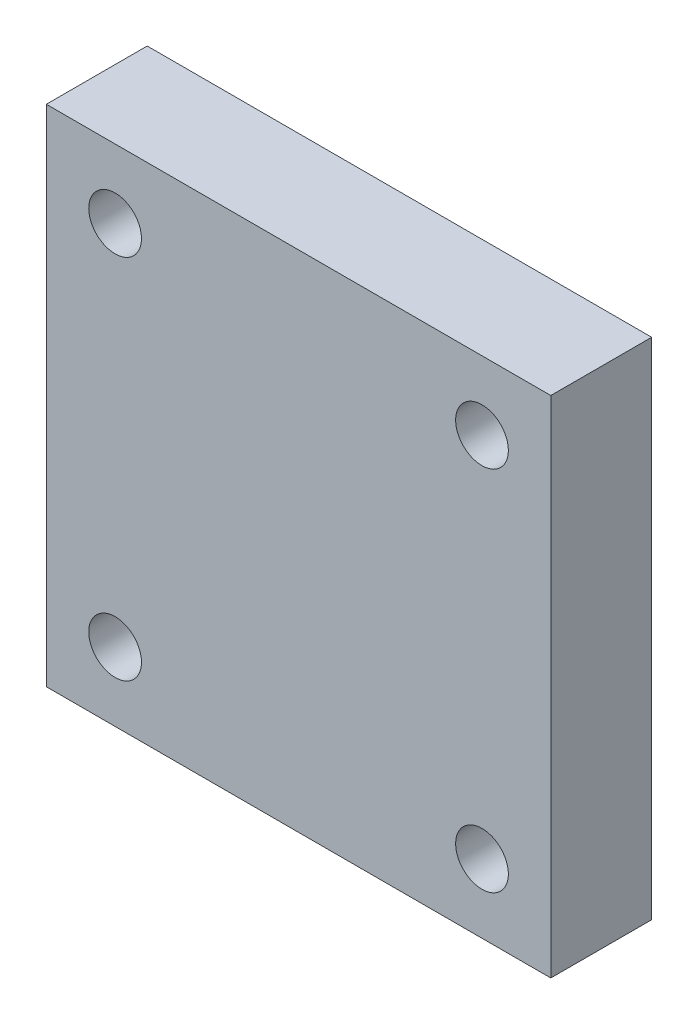
from build123d import *

# Parameters (mm, degrees)
SKETCH1_W           = 27.94
SKETCH1_H           = 27.94
SKETCH1_R           = 1.4605
BOSS_EXTRUDE1_DEPTH = 5.588


with BuildPart() as part:
    # Sketch1 → Boss-Extrude1 (new body)
    with BuildSketch(Plane(origin=(0, 0, 0), x_dir=(0, 1, 0), z_dir=(0, 0, 1))):
        Rectangle(SKETCH1_W, SKETCH1_H)
        with Locations(Location((-10.16, 10.16, 0), (0, 0, 270))):
            Circle(SKETCH1_R, mode=Mode.SUBTRACT)
        with Locations(Location((10.16, 10.16, 0), (0, 0, 90))):
            Circle(SKETCH1_R, mode=Mode.SUBTRACT)
        with Locations(Location((-10.16, -10.16, 0), (0, 0, 90))):
            Circle(SKETCH1_R, mode=Mode.SUBTRACT)
        with Locations(Location((10.16, -10.16, 0), (0, 0, 270))):
            Circle(SKETCH1_R, mode=Mode.SUBTRACT)
    extrude(amount=BOSS_EXTRUDE1_DEPTH)


solid = part.part
